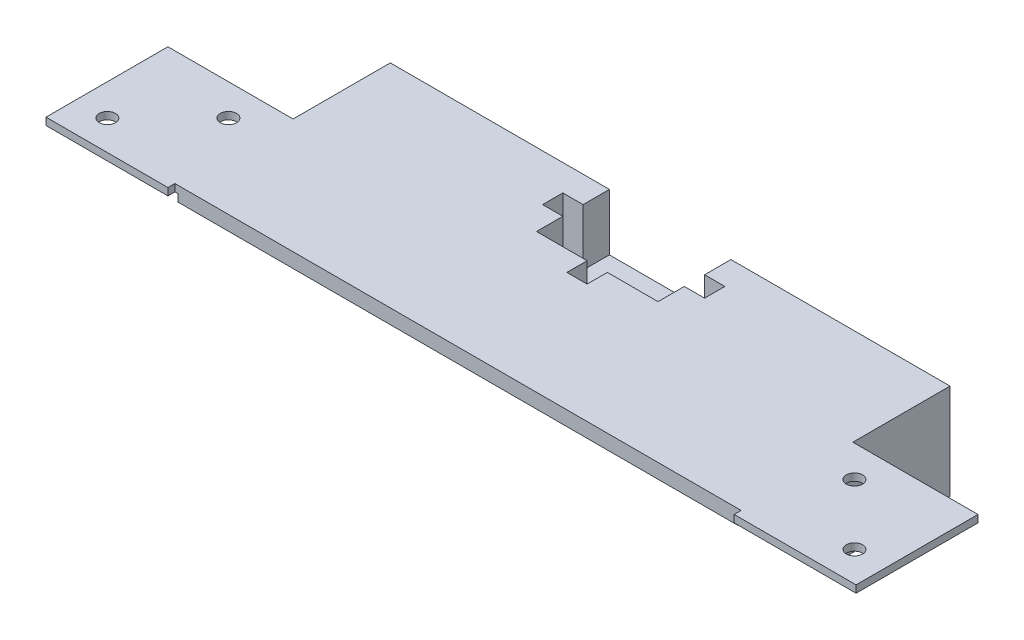
from build123d import *

# Parameters (mm, degrees)
SALIENTE_EXTRUIR1_DEPTH = 1.8
SALIENTE_EXTRUIR2_START = -1.8
SALIENTE_EXTRUIR2_DEPTH = 1.8
SALIENTE_EXTRUIR3_START = -3.6
CROQUIS6_W              = 138.2
CROQUIS6_H              = 3.4
SALIENTE_EXTRUIR3_DEPTH = 20
CROQUIS8_W              = 138.2
CROQUIS8_H              = 23.6
SALIENTE_EXTRUIR4_DEPTH = 24
CROQUIS9_W              = 30
CROQUIS9_H              = 18
CORTAR_EXTRUIR1_DEPTH   = 14
CROQUIS11_R             = 2
CORTAR_EXTRUIR2_DEPTH   = 109.835519375
CORTAR_EXTRUIR4_DEPTH   = 1
CROQUIS14_W             = 5
CROQUIS14_H             = 5
CORTAR_EXTRUIR5_DEPTH   = 14


with BuildPart() as part:
    # Croquis4 → Saliente-Extruir1 (new body)
    with BuildSketch(Plane(origin=(0, 0, 0), x_dir=(1, 0, 0), z_dir=(0, 1, 0))):
        Polygon((100, -35.891646349), (69.9, -35.891646349), (69.9, -34.171646349), (0, -34.171646349), (-69.9, -34.171646349), (-69.9, -35.891646349), (-100, -35.891646349), (-100, -5.791646349), (100, -5.791646349), align=None)
    extrude(amount=SALIENTE_EXTRUIR1_DEPTH)

    # Croquis5 → Saliente-Extruir2 (add)
    with BuildSketch(Plane(origin=(0, 1.8, 0), x_dir=(1, 0, 0), z_dir=(0, 1, 0)).offset(SALIENTE_EXTRUIR2_START)):
        Polygon((-69.1, -34.171646349), (69.1, -34.171646349), (69.1, -9.791646349), (69.1, -5.791646349), (-69.1, -5.791646349), (-69.1, -9.791646349), align=None)
    extrude(amount=-SALIENTE_EXTRUIR2_DEPTH)

    # Croquis6 → Saliente-Extruir3 (add)
    with BuildSketch(Plane(origin=(0, 1.8, 0), x_dir=(1, 0, 0), z_dir=(0, 1, 0)).offset(SALIENTE_EXTRUIR3_START)):
        with Locations((0, -7.491646349)):
            Rectangle(CROQUIS6_W, CROQUIS6_H)
    extrude(amount=-SALIENTE_EXTRUIR3_DEPTH)

    # Croquis8 → Saliente-Extruir4 (add)
    with BuildSketch(Plane(origin=(0, 0, 5.791646349), x_dir=(-1, 0, 0), z_dir=(0, 0, -1))):
        with Locations((0, -10)):
            Rectangle(CROQUIS8_W, CROQUIS8_H)
    extrude(amount=SALIENTE_EXTRUIR4_DEPTH)

    # Croquis9 → Cortar-Extruir1 (cut)
    with BuildSketch(Plane(origin=(0, 1.8, 0), x_dir=(1, 0, 0), z_dir=(0, 1, 0))):
        with Locations((0, 9.208353651)):
            Rectangle(CROQUIS9_W, CROQUIS9_H)
    extrude(amount=-CORTAR_EXTRUIR1_DEPTH, mode=Mode.SUBTRACT)

    # Croquis11 → Cortar-Extruir2 (cut, through all)
    with BuildSketch(Plane(origin=(0, 1.8, 0), x_dir=(1, 0, 0), z_dir=(0, 1, 0))):
        with Locations(Location((92.221825407, -28.513471756, 0), (0, 0, 270))):
            Circle(CROQUIS11_R)
        with Locations(Location((77.278174593, -13.569820942, 0), (0, 0, 270))):
            Circle(CROQUIS11_R)
        with Locations(Location((-77.278174593, -13.569820942, 0), (0, 0, 270))):
            Circle(CROQUIS11_R)
        with Locations(Location((-92.221825407, -28.513471756, 0), (0, 0, 270))):
            Circle(CROQUIS11_R)
    extrude(amount=-CORTAR_EXTRUIR2_DEPTH, mode=Mode.SUBTRACT)

    # Croquis12 → Cortar-Extruir4 (cut)
    # profile 1 of 6: a face of its own
    with BuildSketch(Plane(origin=(0, -21.8, 0), x_dir=(1, 0, 0), z_dir=(0, 1, 0))):
        Polygon((-15.576923077, -5.791646349), (-14.606971154, -5.791646349), (-11.884615385, -1.843329041), (-11.884615385, -5.791646349), (-10.807692308, -5.791646349), (-10.807692308, 0.208353651), (-11.784855769, 0.208353651), (-14.5, -3.727944426), (-14.5, 0.208353651), (-15.576923077, 0.208353651), align=None)
    # profile 2 of 6: a face of its own
    with BuildSketch(Plane(origin=(0, -21.8, 0), x_dir=(1, 0, 0), z_dir=(0, 1, 0))):
        with BuildLine():
            Line((-9.423076923, -5.791646349), (-8.346153846, -5.791646349))
            Line((-8.346153846, -5.791646349), (-8.346153846, -1.887800195))
            add(Edge.make_bspline(
                [(-8.346153846, -1.887800195), (-8.346092907, -1.84732709), (-8.345975204, -1.769153707), (-8.34034485, -1.656996008), (-8.335038311, -1.553517293), (-8.326009405, -1.45955634), (-8.311846929, -1.374821476), (-8.298624265, -1.299000513), (-8.280495748, -1.232769153), (-8.25334821, -1.157328937), (-8.210964769, -1.072579941), (-8.143740887, -0.983251022), (-8.063464187, -0.903740742), (-7.968926102, -0.836980203), (-7.863377616, -0.78051337), (-7.744738665, -0.743165289), (-7.616866027, -0.717832756), (-7.527777066, -0.715779152), (-7.481971154, -0.714723272)],
                knots=[0, 0, 0, 0, 1.155195489, 2.231248153, 3.20507519, 4.113220553, 4.92363642, 5.657123012, 6.309133385, 6.880755525, 7.944644177, 8.999147208, 10.058600405, 11.156792429, 12.29246015, 13.460660758, 14.694375292, 16, 16, 16, 16], degree=3))
            add(Edge.make_bspline(
                [(-7.481971154, -0.714723272), (-7.433355059, -0.716126462), (-7.338561904, -0.718862445), (-7.201940021, -0.746298033), (-7.075006761, -0.788966665), (-6.961230175, -0.851108146), (-6.860199788, -0.924464022), (-6.776380217, -1.010115979), (-6.707349066, -1.103686699), (-6.66395483, -1.191785135), (-6.638785445, -1.27210131), (-6.62229751, -1.344479828), (-6.608241519, -1.428778583), (-6.595886894, -1.525360297), (-6.588695507, -1.634555546), (-6.580603754, -1.755883647), (-6.577687987, -1.889389833), (-6.577185243, -1.982352092), (-6.576923077, -2.030829041)],
                knots=[0, 0, 0, 0, 1.260834212, 2.45841325, 3.603280198, 4.724942815, 5.811019112, 6.833506895, 7.823953325, 8.819576102, 9.365694356, 10.006623749, 10.745436914, 11.584131356, 12.533575865, 13.586103333, 14.74122738, 16, 16, 16, 16], degree=3))
            Line((-6.576923077, -2.030829041), (-6.576923077, -5.791646349))
            Line((-6.576923077, -5.791646349), (-5.5, -5.791646349))
            Line((-5.5, -5.791646349), (-5.5, -2.212319426))
            add(Edge.make_bspline(
                [(-5.5, -2.212319426), (-5.500130194, -2.139801093), (-5.500380546, -2.000355412), (-5.505051849, -1.79998352), (-5.51360914, -1.616876681), (-5.524231447, -1.451366786), (-5.536969727, -1.302981027), (-5.553455277, -1.1717951), (-5.573621774, -1.057879352), (-5.603845728, -0.928215254), (-5.655934107, -0.778907915), (-5.739933258, -0.606985995), (-5.846564971, -0.438674625), (-5.972570921, -0.27577078), (-6.114953186, -0.124603588), (-6.26988959, 0.008549456), (-6.436540284, 0.11889328), (-6.613756054, 0.209086285), (-6.804827635, 0.277901285), (-7.009668317, 0.326317601), (-7.229015011, 0.357512926), (-7.380097266, 0.360606196), (-7.457932692, 0.362199805)],
                knots=[0, 0, 0, 0, 1.170912322, 2.251550202, 3.235884933, 4.130507595, 4.929373885, 5.640290569, 6.26461063, 6.796528574, 7.788739464, 8.810047518, 9.879767716, 11.000329969, 12.130634485, 13.227340211, 14.291294104, 15.350161901, 16.430664233, 17.561930962, 18.743941553, 20, 20, 20, 20], degree=3))
            add(Edge.make_bspline(
                [(-7.457932692, 0.362199805), (-7.50965277, 0.36132604), (-7.611695424, 0.35960212), (-7.76178081, 0.344483993), (-7.906815132, 0.322015469), (-8.046889418, 0.289896539), (-8.181469304, 0.245963046), (-8.311278885, 0.194491677), (-8.436454855, 0.134486821), (-8.554178173, 0.062972235), (-8.666904054, -0.013164244), (-8.771741109, -0.095067952), (-8.868222579, -0.181723027), (-8.95626717, -0.273264567), (-9.035870427, -0.369661793), (-9.107054202, -0.470901875), (-9.169663633, -0.577036525), (-9.225288053, -0.689962498), (-9.272891863, -0.81542463), (-9.313043875, -0.957880751), (-9.347948878, -1.119192912), (-9.37437211, -1.300423749), (-9.397660897, -1.500748108), (-9.412751075, -1.720930469), (-9.420540221, -1.960258387), (-9.42220999, -2.126176038), (-9.423076923, -2.212319426)],
                knots=[0, 0, 0, 0, 1.001274302, 1.975493657, 2.918061388, 3.842055805, 4.754744607, 5.656586832, 6.54484551, 7.438946169, 8.321187755, 9.177850665, 10.012845812, 10.830395126, 11.634995211, 12.431362049, 13.224358528, 14.018909421, 14.866105371, 15.818803578, 16.882454076, 18.059767828, 19.363726729, 20.787034531, 22.331848803, 24, 24, 24, 24], degree=3))
            Line((-9.423076923, -2.212319426), (-9.423076923, -5.791646349))
        make_face()
    # profile 3 of 6: a face of its own
    with BuildSketch(Plane(origin=(0, -21.8, 0), x_dir=(1, 0, 0), z_dir=(0, 1, 0))):
        Polygon((-4.730769231, -5.791646349), (-1.5, -5.791646349), (-1.5, -4.714723272), (-2.576923077, -4.714723272), (-2.576923077, 0.208353651), (-3.653846154, 0.208353651), (-3.653846154, -4.714723272), (-4.730769231, -4.714723272), align=None)
    # profile 4 of 6: a face of its own
    with BuildSketch(Plane(origin=(0, -21.8, 0), x_dir=(1, 0, 0), z_dir=(0, 1, 0))):
        with BuildLine():
            Line((1.653846154, 0.208353651), (1.653846154, -5.791646349))
            Line((1.653846154, -5.791646349), (2.615384615, -5.791646349))
            add(Edge.make_bspline(
                [(2.615384615, -5.791646349), (2.68269844, -5.791655538), (2.812949414, -5.791673319), (3.000865633, -5.785054034), (3.17474974, -5.77660504), (3.334813937, -5.766835127), (3.480998968, -5.750620795), (3.613405512, -5.733171111), (3.731543175, -5.7122669), (3.804580381, -5.693503052), (3.838942308, -5.684675195)],
                knots=[0, 0, 0, 0, 1.311970222, 2.538637508, 3.664491357, 4.705491327, 5.663608299, 6.530571107, 7.308675535, 8, 8, 8, 8], degree=3))
            add(Edge.make_bspline(
                [(3.838942308, -5.684675195), (3.8840627, -5.672223782), (3.972603395, -5.647790113), (4.099428615, -5.598454194), (4.219714263, -5.543580461), (4.333434035, -5.48110164), (4.439242997, -5.409852503), (4.538591564, -5.331191998), (4.631017604, -5.245093539), (4.715047879, -5.151046985), (4.79089395, -5.051529569), (4.857064313, -4.946494906), (4.914220805, -4.837607708), (4.958108929, -4.722988755), (4.994963831, -4.60563139), (5.019620546, -4.483151847), (5.036164657, -4.356605204), (5.037688179, -4.270467246), (5.038461538, -4.226742502)],
                knots=[0, 0, 0, 0, 1.099879008, 2.158315707, 3.195196496, 4.207130292, 5.205157476, 6.190838564, 7.183874245, 8.171129509, 9.152705923, 10.122275948, 11.08707516, 12.038677937, 13.004120747, 13.975884785, 14.972532894, 16, 16, 16, 16], degree=3))
            add(Edge.make_bspline(
                [(5.038461538, -4.226742502), (5.036585368, -4.170537346), (5.032890142, -4.05983803), (5.004532434, -3.897993633), (4.958832326, -3.744182604), (4.894254037, -3.597073214), (4.807561166, -3.45688824), (4.699452972, -3.320968345), (4.567240424, -3.191169367), (4.467508468, -3.111662601), (4.415865385, -3.070492502)],
                knots=[0, 0, 0, 0, 0.986462413, 1.942894939, 2.875435142, 3.798266677, 4.755009598, 5.761362919, 6.840791609, 8, 8, 8, 8], degree=3))
            add(Edge.make_bspline(
                [(4.415865385, -3.070492502), (4.458172733, -3.0489018), (4.541125737, -3.006568406), (4.658821686, -2.936905142), (4.7680694, -2.863110616), (4.86811067, -2.785298618), (4.96131426, -2.705013868), (5.041893182, -2.617338787), (5.117808369, -2.529040712), (5.18280124, -2.434429298), (5.238994011, -2.335526084), (5.288844546, -2.233449307), (5.32956277, -2.126169129), (5.364613881, -2.015220036), (5.39117514, -1.899455746), (5.408353704, -1.779598005), (5.421532699, -1.65571709), (5.422556415, -1.571331181), (5.423076923, -1.528425195)],
                knots=[0, 0, 0, 0, 1.164301211, 2.282872552, 3.350830854, 4.394111106, 5.389302619, 6.362088852, 7.310365691, 8.24222091, 9.170601078, 10.097577168, 11.024240953, 11.981127157, 12.948542686, 13.932080445, 14.948567018, 16, 16, 16, 16], degree=3))
            add(Edge.make_bspline(
                [(5.423076923, -1.528425195), (5.419867548, -1.446435232), (5.413530666, -1.284546831), (5.362253825, -1.047768939), (5.280408311, -0.822137642), (5.165651078, -0.611269962), (5.025823368, -0.41890813), (4.865716059, -0.249013931), (4.685171945, -0.106737843), (4.519716368, -0.009728718), (4.37584743, 0.054954965), (4.256192941, 0.094588728), (4.127765068, 0.131324755), (3.989125633, 0.159785639), (3.840966073, 0.180992089), (3.683354106, 0.196442209), (3.515746142, 0.206186281), (3.400654778, 0.207616589), (3.341346154, 0.208353651)],
                knots=[0, 0, 0, 0, 1.284225818, 2.535691644, 3.779474941, 5.035581115, 6.285533147, 7.498311102, 8.683187976, 9.876672238, 10.49522506, 11.152635743, 11.850557634, 12.588370465, 13.369094102, 14.195874568, 15.07030211, 16, 16, 16, 16], degree=3))
            Line((3.341346154, 0.208353651), (1.653846154, 0.208353651))
        make_face()
        with BuildLine():
            Line((2.730769231, -4.714723272), (2.730769231, -3.407030964))
            Line((2.730769231, -3.407030964), (3.016826923, -3.407030964))
            add(Edge.make_bspline(
                [(3.016826923, -3.407030964), (3.055705216, -3.407368448), (3.130757408, -3.408019941), (3.239154531, -3.416470048), (3.339974528, -3.430780163), (3.433084015, -3.451169806), (3.519026893, -3.475876945), (3.596785309, -3.507302062), (3.666611765, -3.544797145), (3.748884467, -3.599286543), (3.833630277, -3.682730351), (3.909515643, -3.800517314), (3.95398986, -3.936851473), (3.958967883, -4.032909017), (3.961538462, -4.082511733)],
                knots=[0, 0, 0, 0, 1.06517797, 2.056261606, 2.976983468, 3.853439442, 4.666321732, 5.424739265, 6.146762548, 6.834937974, 8.123729748, 9.372478121, 10.64318598, 12, 12, 12, 12], degree=3))
            add(Edge.make_bspline(
                [(3.961538462, -4.082511733), (3.959482289, -4.128975389), (3.955506761, -4.218811001), (3.910696019, -4.345034442), (3.840889647, -4.456312626), (3.75971714, -4.533572759), (3.682313672, -4.585517393), (3.615685024, -4.620153663), (3.542462809, -4.650907831), (3.46085077, -4.672383329), (3.373294425, -4.692540316), (3.277907928, -4.704796852), (3.175656533, -4.713843925), (3.10499135, -4.714423869), (3.068509615, -4.714723272)],
                knots=[0, 0, 0, 0, 1.347812291, 2.605940898, 3.848830773, 5.144272192, 5.83350599, 6.558918059, 7.32804622, 8.140548749, 9.012446266, 9.943019774, 10.938059685, 12, 12, 12, 12], degree=3))
            Line((3.068509615, -4.714723272), (2.730769231, -4.714723272))
        make_face(mode=Mode.SUBTRACT)
        with BuildLine():
            Line((2.730769231, -2.407030964), (2.730769231, -0.868569426))
            Line((2.730769231, -0.868569426), (3.040865385, -0.868569426))
            add(Edge.make_bspline(
                [(3.040865385, -0.868569426), (3.102170281, -0.868925974), (3.220036596, -0.869611482), (3.388903846, -0.877664661), (3.542363193, -0.892601177), (3.680450748, -0.910040281), (3.802036234, -0.937614387), (3.909340213, -0.966284357), (4.00050328, -1.003161998), (4.077081199, -1.045926852), (4.141126217, -1.094301564), (4.196584784, -1.146655436), (4.242841375, -1.205155468), (4.280041972, -1.268507578), (4.311291952, -1.336127189), (4.330435004, -1.410258838), (4.344941655, -1.488597129), (4.345743563, -1.542773843), (4.346153846, -1.570492502)],
                knots=[0, 0, 0, 0, 1.753677247, 3.371663338, 4.833688836, 6.164395063, 7.349095089, 8.3975697, 9.338276771, 10.154261968, 10.899224605, 11.628775934, 12.330426574, 13.024264642, 13.727131073, 14.452891561, 15.208446408, 16, 16, 16, 16], degree=3))
            add(Edge.make_bspline(
                [(4.346153846, -1.570492502), (4.345253472, -1.602190987), (4.343499785, -1.663931108), (4.329131817, -1.754154885), (4.303136628, -1.838445536), (4.269883263, -1.918989025), (4.22498869, -1.99358871), (4.170147825, -2.062741235), (4.105848153, -2.126650436), (4.031886588, -2.186285171), (3.946012267, -2.239852612), (3.846249849, -2.283177738), (3.735176717, -2.322262721), (3.610618395, -2.352475836), (3.473550264, -2.378390039), (3.322784204, -2.393798857), (3.159632642, -2.405281744), (3.046498175, -2.406434642), (2.987980769, -2.407030964)],
                knots=[0, 0, 0, 0, 0.844862234, 1.645564352, 2.426138401, 3.19188377, 3.963047654, 4.738710309, 5.53926994, 6.37496817, 7.267116735, 8.227971149, 9.268346748, 10.402975021, 11.641070045, 12.984514716, 14.440277492, 16, 16, 16, 16], degree=3))
            Line((2.987980769, -2.407030964), (2.730769231, -2.407030964))
        make_face(mode=Mode.SUBTRACT)
    # profile 5 of 6: a face of its own
    with BuildSketch(Plane(origin=(0, -21.8, 0), x_dir=(1, 0, 0), z_dir=(0, 1, 0))):
        with BuildLine():
            add(Edge.make_bspline(
                [(9.319711538, -5.945492502), (9.424029412, -5.942792625), (9.629976523, -5.937462454), (9.932841389, -5.892997821), (10.22474269, -5.820632461), (10.505722268, -5.719622073), (10.774821845, -5.588804561), (11.033030162, -5.429966662), (11.279639626, -5.241760571), (11.511775017, -5.026871997), (11.724637487, -4.791898065), (11.911746017, -4.541382003), (12.070577442, -4.277910282), (12.199501294, -4.00143157), (12.300181524, -3.712325639), (12.370153099, -3.41048277), (12.415269113, -3.09628949), (12.420445917, -2.882348603), (12.423076923, -2.773617502)],
                knots=[0, 0, 0, 0, 1.014151002, 2.002163778, 2.969868608, 3.93493411, 4.9003771, 5.874719092, 6.87846472, 7.912488755, 8.947011879, 9.957751389, 10.948740761, 11.933621513, 12.919426746, 13.920294397, 14.943031967, 16, 16, 16, 16], degree=3))
            add(Edge.make_bspline(
                [(12.423076923, -2.773617502), (12.420274131, -2.666111757), (12.414751139, -2.454268236), (12.372000389, -2.142967424), (12.300812686, -1.844368756), (12.20207345, -1.558370151), (12.075403859, -1.28496692), (11.918998097, -1.025046226), (11.733883755, -0.77807401), (11.523842196, -0.54556332), (11.29403125, -0.333139991), (11.049171843, -0.146658402), (10.791538844, 0.010189829), (10.52277831, 0.140377227), (10.240354792, 0.238209352), (9.947399497, 0.311436987), (9.64146177, 0.353781238), (9.433621, 0.359365394), (9.328125, 0.362199805)],
                knots=[0, 0, 0, 0, 1.051517626, 2.07204922, 3.067438659, 4.05042616, 5.027204762, 6.009981242, 7.012629434, 8.042243656, 9.071350414, 10.070091277, 11.048190212, 12.017682766, 12.985867053, 13.966945899, 14.968060614, 16, 16, 16, 16], degree=3))
            add(Edge.make_bspline(
                [(9.328125, 0.362199805), (9.217780293, 0.359687006), (9.000968028, 0.3547497), (8.683583542, 0.308194245), (8.379935163, 0.237214254), (8.090854893, 0.134452305), (7.81656746, 0.00092746), (7.555842801, -0.160293602), (7.310641797, -0.352325084), (7.081781776, -0.569374994), (6.874458195, -0.806936792), (6.691448156, -1.057883782), (6.537076712, -1.320318199), (6.411335936, -1.594357856), (6.312207062, -1.878300971), (6.24228288, -2.173876492), (6.200977002, -2.480375616), (6.195223333, -2.688555944), (6.192307692, -2.794050195)],
                knots=[0, 0, 0, 0, 1.067953136, 2.098381936, 3.099641766, 4.083805132, 5.062469929, 6.048665414, 7.046702845, 8.073106546, 9.098695993, 10.09591865, 11.076726721, 12.041940862, 13.011263376, 13.984305721, 14.978557872, 16, 16, 16, 16], degree=3))
            add(Edge.make_bspline(
                [(6.192307692, -2.794050195), (6.193235414, -2.865018127), (6.195079109, -3.006055375), (6.21680072, -3.215119628), (6.249016525, -3.419803572), (6.293119189, -3.620492111), (6.352540142, -3.816668054), (6.424761485, -4.008826246), (6.508922112, -4.196965625), (6.60597395, -4.379384736), (6.715758941, -4.553901032), (6.832979692, -4.72203875), (6.962126002, -4.879383941), (7.100532236, -5.027645761), (7.248740519, -5.166146473), (7.407008973, -5.295358996), (7.575088485, -5.414953765), (7.751161052, -5.525919047), (7.934624371, -5.623107394), (8.121113503, -5.711201514), (8.312418724, -5.782628203), (8.507151025, -5.841786036), (8.704862703, -5.889262599), (8.907080263, -5.920830466), (9.112097035, -5.94272368), (9.250342467, -5.944567371), (9.319711538, -5.945492502)],
                knots=[0, 0, 0, 0, 1.034641744, 2.056182551, 3.061960284, 4.05571729, 5.050247014, 6.048716841, 7.047801973, 8.054190544, 9.059424999, 10.053182006, 11.041513076, 12.025412457, 13.009311837, 13.997642908, 15.002928308, 16.016213968, 17.030509951, 18.02913364, 19.022134519, 20.005478534, 20.996155877, 21.984625117, 22.988721131, 24, 24, 24, 24], degree=3))
        make_face()
        with BuildLine():
            add(Edge.make_bspline(
                [(9.302884615, -4.868569426), (9.232679054, -4.86668565), (9.094121369, -4.862967832), (8.89088242, -4.834643151), (8.695766076, -4.789405241), (8.509852894, -4.723879309), (8.332340985, -4.640479181), (8.162901184, -4.53950636), (8.003934823, -4.417451417), (7.853110314, -4.281013047), (7.717324663, -4.128361353), (7.595234969, -3.966551415), (7.496520497, -3.791689813), (7.411640143, -3.609536015), (7.348942874, -3.415483546), (7.301205441, -3.212681861), (7.275204481, -2.999049056), (7.271250375, -2.853809788), (7.269230769, -2.779627118)],
                knots=[0, 0, 0, 0, 1.033668485, 2.040047952, 3.016132939, 3.979056467, 4.937231767, 5.900589077, 6.877725736, 7.88429546, 8.891280164, 9.882584218, 10.863295226, 11.842887319, 12.837417301, 13.860812229, 14.907384602, 16, 16, 16, 16], degree=3))
            add(Edge.make_bspline(
                [(7.269230769, -2.779627118), (7.271685699, -2.697393139), (7.276496956, -2.536228165), (7.309857052, -2.300999011), (7.368310443, -2.07910401), (7.448164819, -1.869800846), (7.554314064, -1.675290462), (7.681270956, -1.493214748), (7.832214219, -1.324703387), (7.948295333, -1.226237464), (8.007211538, -1.176261733)],
                knots=[0, 0, 0, 0, 1.078343132, 2.113373867, 3.107373148, 4.082093053, 5.043582658, 6.005574554, 6.987742499, 8, 8, 8, 8], degree=3))
            add(Edge.make_bspline(
                [(8.007211538, -1.176261733), (8.055488016, -1.139347437), (8.150953294, -1.06635053), (8.303336661, -0.972790019), (8.460261524, -0.892599327), (8.622912077, -0.827806197), (8.790944811, -0.77684101), (8.964336683, -0.741150928), (9.142842012, -0.718752315), (9.26355568, -0.716075256), (9.324519231, -0.714723272)],
                knots=[0, 0, 0, 0, 1.023928204, 2.024787132, 3.009472467, 3.9914905, 4.972207045, 5.96565515, 6.972602802, 8, 8, 8, 8], degree=3))
            add(Edge.make_bspline(
                [(9.324519231, -0.714723272), (9.393516271, -0.716625715), (9.529270116, -0.720368831), (9.728744732, -0.748306329), (9.91975883, -0.795793571), (10.104082909, -0.860279526), (10.27924873, -0.946701874), (10.447987875, -1.049321785), (10.608289262, -1.171339753), (10.758198716, -1.311216484), (10.895582716, -1.463875378), (11.017129323, -1.626560529), (11.117789951, -1.799278269), (11.201753728, -1.979721461), (11.267170859, -2.169326812), (11.311939398, -2.368108622), (11.340711281, -2.575264897), (11.344316971, -2.716228437), (11.346153846, -2.788040579)],
                knots=[0, 0, 0, 0, 1.026350473, 2.019376834, 2.989435443, 3.95094063, 4.91865229, 5.889827372, 6.885283771, 7.910196595, 8.935871797, 9.9372888, 10.925850568, 11.904605667, 12.894245083, 13.903507864, 14.931967858, 16, 16, 16, 16], degree=3))
            add(Edge.make_bspline(
                [(11.346153846, -2.788040579), (11.344260531, -2.859442728), (11.340533829, -2.999986969), (11.31243977, -3.206568567), (11.265734353, -3.404258137), (11.199724671, -3.593565271), (11.117490343, -3.775483817), (11.014190336, -3.94843488), (10.892063731, -4.112268824), (10.753343104, -4.266011638), (10.602379063, -4.407300906), (10.440297535, -4.529911895), (10.271641495, -4.636457572), (10.092539122, -4.719921003), (9.906655228, -4.786416181), (9.712855397, -4.835384175), (9.510405641, -4.862768856), (9.372674884, -4.866618668), (9.302884615, -4.868569426)],
                knots=[0, 0, 0, 0, 1.055040155, 2.076685641, 3.074845078, 4.052329834, 5.035358467, 6.020382375, 7.023447318, 8.050688466, 9.077178457, 10.074336316, 11.0503314, 12.019748348, 12.988025369, 13.964577102, 14.968620271, 16, 16, 16, 16], degree=3))
        make_face(mode=Mode.SUBTRACT)
    # profile 6 of 6: a face of its own
    with BuildSketch(Plane(origin=(0, -21.8, 0), x_dir=(1, 0, 0), z_dir=(0, 1, 0))):
        Polygon((12.884615385, -5.791646349), (16.115384615, -5.791646349), (16.115384615, -4.714723272), (15.038461538, -4.714723272), (15.038461538, 0.208353651), (13.961538462, 0.208353651), (13.961538462, -4.714723272), (12.884615385, -4.714723272), align=None)
    extrude(amount=CORTAR_EXTRUIR4_DEPTH, mode=Mode.SUBTRACT)

    # Croquis14 → Cortar-Extruir5 (cut)
    with BuildSketch(Plane(origin=(0, 1.8, 0), x_dir=(1, 0, 0), z_dir=(0, 1, 0))):
        with Locations((17.5, 9.208353651)):
            Rectangle(CROQUIS14_W, CROQUIS14_H)
        with Locations((-17.5, 9.208353651)):
            Rectangle(CROQUIS14_W, CROQUIS14_H)
        with Locations((0, -2.291646349)):
            Rectangle(CROQUIS14_W, CROQUIS14_H)
    extrude(amount=-CORTAR_EXTRUIR5_DEPTH, mode=Mode.SUBTRACT)


solid = part.part
